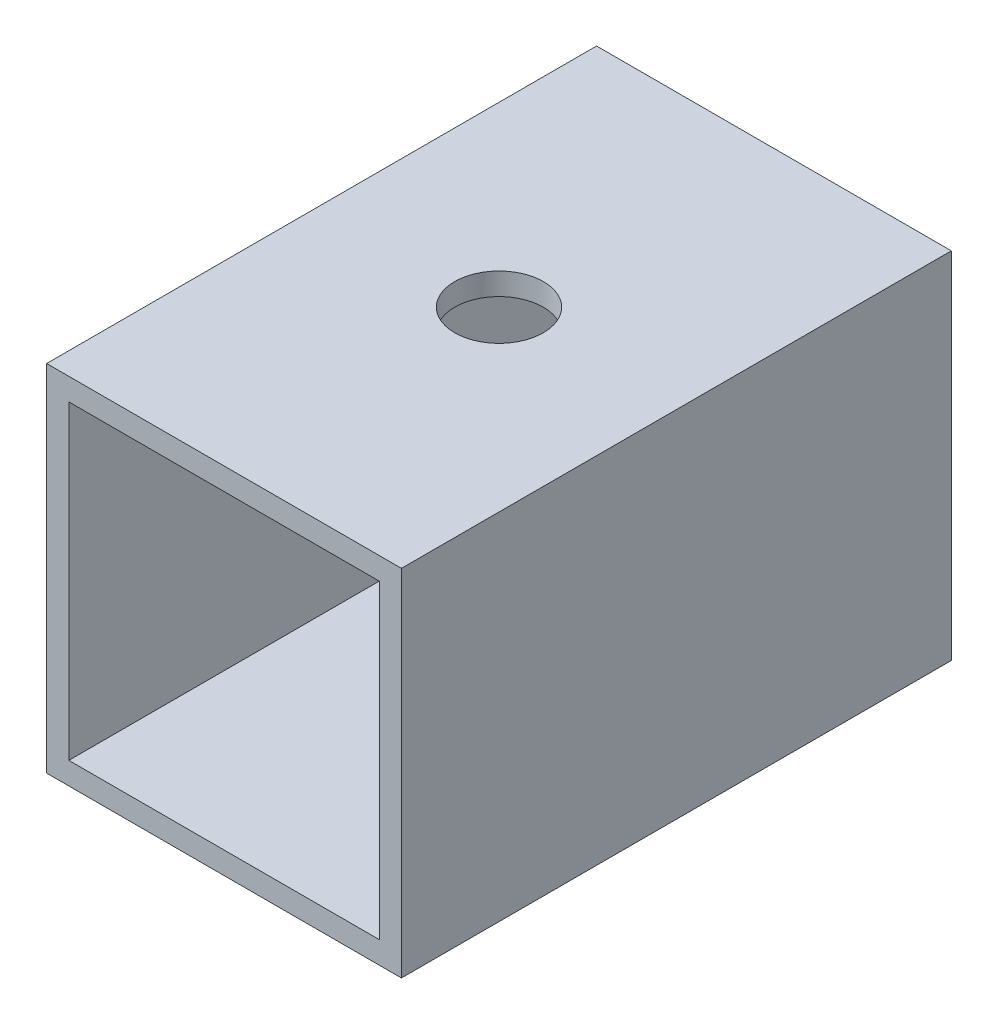
from build123d import *

# Parameters (mm, degrees)
SKETCH1_W           = 25.4
SKETCH1_H           = 25.4
SKETCH1_W_2         = 22.225
SKETCH1_H_2         = 22.225
BOSS_EXTRUDE1_DEPTH = 39.37
SKETCH2_R           = 3.175
CUT_EXTRUDE1_DEPTH  = 25.4


with BuildPart() as part:
    # Sketch1 → Boss-Extrude1 (new body)
    with BuildSketch(Plane.XY):
        Rectangle(SKETCH1_W, SKETCH1_H)
        Rectangle(SKETCH1_W_2, SKETCH1_H_2, mode=Mode.SUBTRACT)
    extrude(amount=BOSS_EXTRUDE1_DEPTH)

    # Sketch2 → Cut-Extrude1 (cut)
    with BuildSketch(Plane(origin=(0, 12.7, 0), x_dir=(1, 0, 0), z_dir=(0, 1, 0))):
        with Locations(Location((0, -19.685, 0), (0, 0, 270))):
            Circle(SKETCH2_R)
    extrude(amount=-CUT_EXTRUDE1_DEPTH, mode=Mode.SUBTRACT)


solid = part.part
